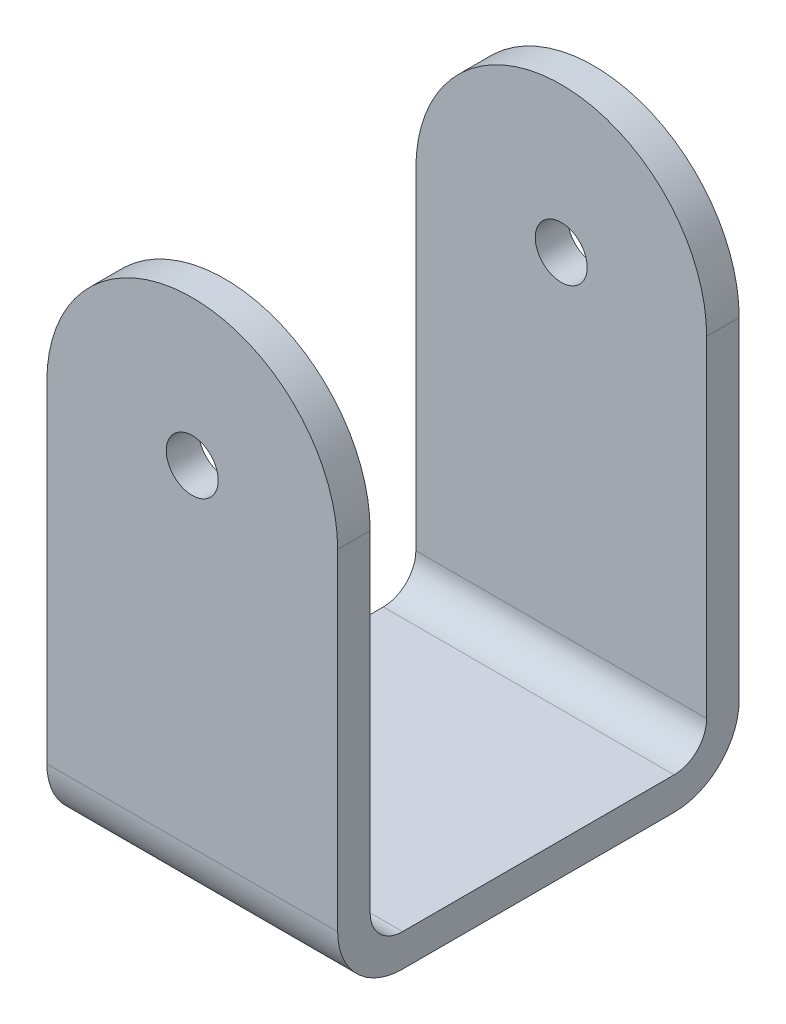
from build123d import *

# Parameters (mm, degrees)
BOSS_EXTRUDE2_DEPTH = 71.12
CUT_EXTRUDE1_DEPTH  = 180.537265516
SKETCH6_3_R         = 6.35
CUT_EXTRUDE2_DEPTH  = 180.537265516


with BuildPart() as part:
    # Sketch1 → Boss-Extrude2 (new body)
    with BuildSketch(Plane(origin=(0, 0, 0), x_dir=(0, 0, -1), z_dir=(1, 0, 0))):
        with BuildLine():
            Line((33.224679849, 0), (-33.224679849, 0))
            ThreePointArc((-33.224679849, 0), (-44.45, 4.649679849), (-49.099679849, 15.875))
            Line((-49.099679849, 15.875), (-49.099679849, 132.4102))
            Line((-49.099679849, 132.4102), (-41.149479849, 132.4102))
            Line((-41.149479849, 132.4102), (-41.149479849, 15.9004))
            ThreePointArc((-41.149479849, 15.9004), (-38.82092018, 10.278759668), (-33.199279849, 7.9502))
            Line((-33.199279849, 7.9502), (33.199279849, 7.9502))
            ThreePointArc((33.199279849, 7.9502), (38.82092018, 10.278759668), (41.149479849, 15.9004))
            Line((41.149479849, 15.9004), (41.149479849, 132.4102))
            Line((41.149479849, 132.4102), (49.099679849, 132.4102))
            Line((49.099679849, 132.4102), (49.099679849, 15.875))
            ThreePointArc((49.099679849, 15.875), (44.45, 4.649679849), (33.224679849, 0))
        make_face()
    extrude(amount=BOSS_EXTRUDE2_DEPTH)

    # Sketch6 → Cut-Extrude1 (cut, through all)
    with BuildSketch(Plane.XY.offset(49.099679849)):
        with BuildLine():
            Line((0, 132.4102), (0, 96.8502))
            ThreePointArc((0, 96.8502), (10.415282861, 121.994917139), (35.56, 132.4102))
            Line((35.56, 132.4102), (0, 132.4102))
        make_face()
        with BuildLine():
            Line((71.12, 132.4102), (35.56, 132.4102))
            ThreePointArc((35.56, 132.4102), (60.704717139, 121.994917139), (71.12, 96.8502))
            Line((71.12, 96.8502), (71.12, 132.4102))
        make_face()
    extrude(amount=-CUT_EXTRUDE1_DEPTH, mode=Mode.SUBTRACT)

    # Sketch6<3> → Cut-Extrude2 (cut, through all)
    with BuildSketch(Plane.XY.offset(49.099679849)):
        with Locations((35.56, 96.8502)):
            Circle(SKETCH6_3_R)
    extrude(amount=-CUT_EXTRUDE2_DEPTH, mode=Mode.SUBTRACT)


solid = part.part
